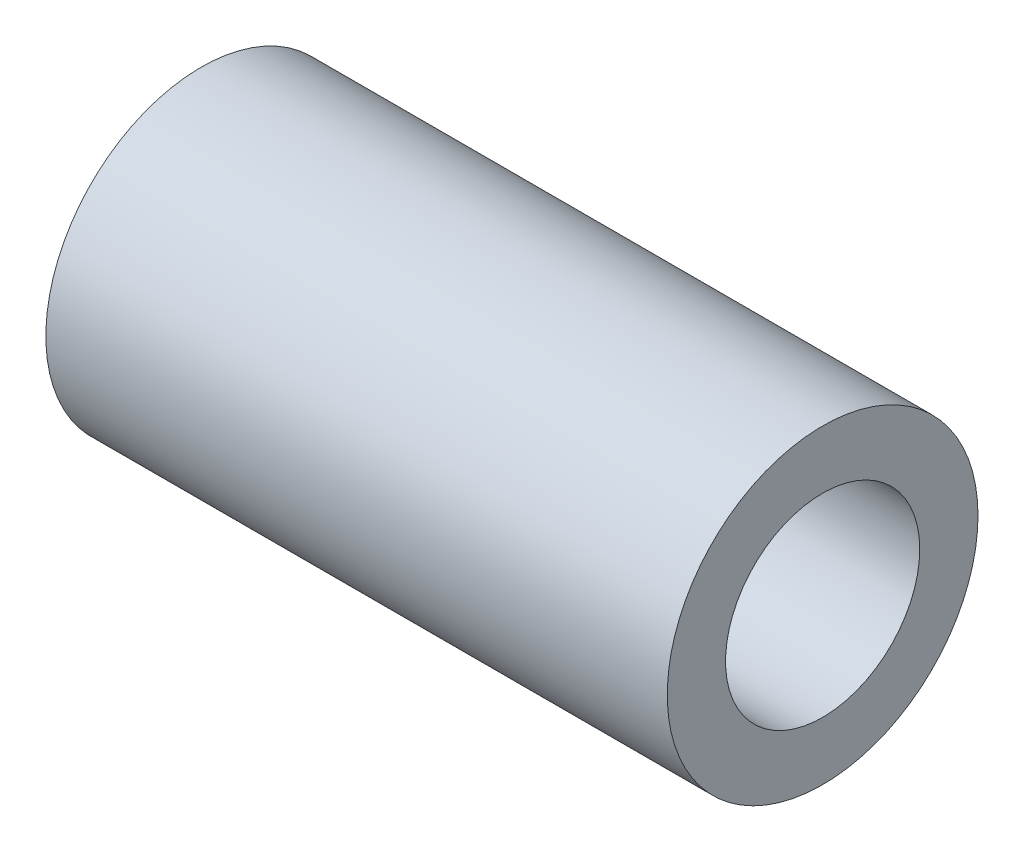
from build123d import *

# Parameters (mm, degrees)
SKETCH_1_R      = 2
SKETCH_1_R_2    = 1.25
EXTRUDE_1_DEPTH = 8


with BuildPart() as part:
    # 草图1 → 凸台-拉伸1 (new body)
    with BuildSketch(Plane(origin=(0, 0, 0), x_dir=(0, 0, -1), z_dir=(1, 0, 0))):
        Circle(SKETCH_1_R)
        Circle(SKETCH_1_R_2, mode=Mode.SUBTRACT)
    extrude(amount=EXTRUDE_1_DEPTH)


solid = part.part
